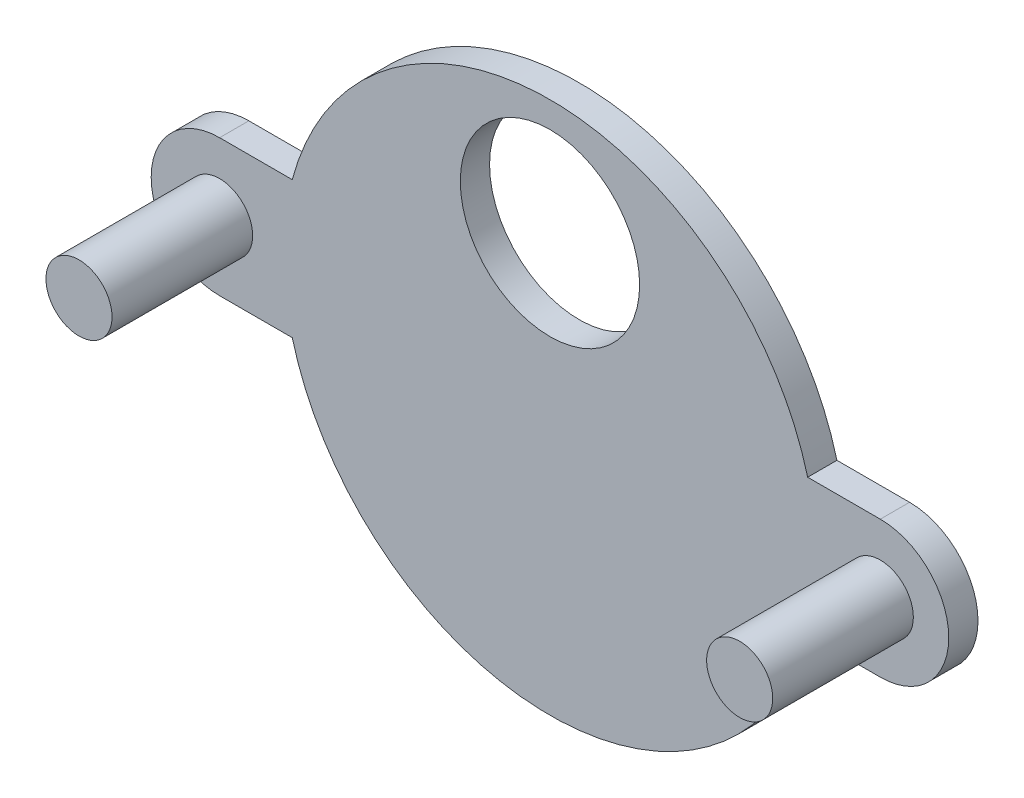
from build123d import *

# Parameters (mm, degrees)
SKETCH1_R           = 14.125
BOSS_EXTRUDE1_DEPTH = 1.55
BOSS_EXTRUDE2_DEPTH = 1.55
SKETCH4_R           = 1.75
BOSS_EXTRUDE3_DEPTH = 9
CUT_EXTRUDE1_REACH  = 28.959
SKETCH5_R           = 4.75


with BuildPart() as part:
    # Sketch1 → Boss-Extrude1 (new body)
    with BuildSketch(Plane.XY):
        with Locations(Location((0, 0, 0), (0, 0, 180))):
            Circle(SKETCH1_R)
    extrude(amount=BOSS_EXTRUDE1_DEPTH)

    # Sketch2 → Boss-Extrude2 (add)
    with BuildSketch(Plane.XY):
        with BuildLine():
            Line((-17.5, 3.625), (17.5, 3.625))
            ThreePointArc((17.5, 3.625), (21.125, 0), (17.5, -3.625))
            Line((17.5, -3.625), (-17.5, -3.625))
            ThreePointArc((-17.5, -3.625), (-21.125, 0), (-17.5, 3.625))
        make_face()
    extrude(amount=BOSS_EXTRUDE2_DEPTH)

    # Sketch4 → Boss-Extrude3 (add)
    with BuildSketch(Plane.XY):
        with Locations((-17.5, 0)):
            Circle(SKETCH4_R)
        with Locations((17.5, 0)):
            Circle(SKETCH4_R)
    extrude(amount=BOSS_EXTRUDE3_DEPTH)

    # Sketch5 → Cut-Extrude1 (cut, up to next)
    with BuildSketch(Plane(origin=(0, 0, 0), x_dir=(-1, 0, 0), z_dir=(0, 0, -1)), mode=Mode.PRIVATE) as cut_extrude1_sk1:
        with Locations((0, 8)):
            Circle(SKETCH5_R)
    cut_extrude1_tool1 = extrude(cut_extrude1_sk1.sketch, amount=-CUT_EXTRUDE1_REACH, mode=Mode.PRIVATE) & part.part
    add(cut_extrude1_tool1.solids().sort_by_distance((0, 8, 0))[0], mode=Mode.SUBTRACT)


solid = part.part
